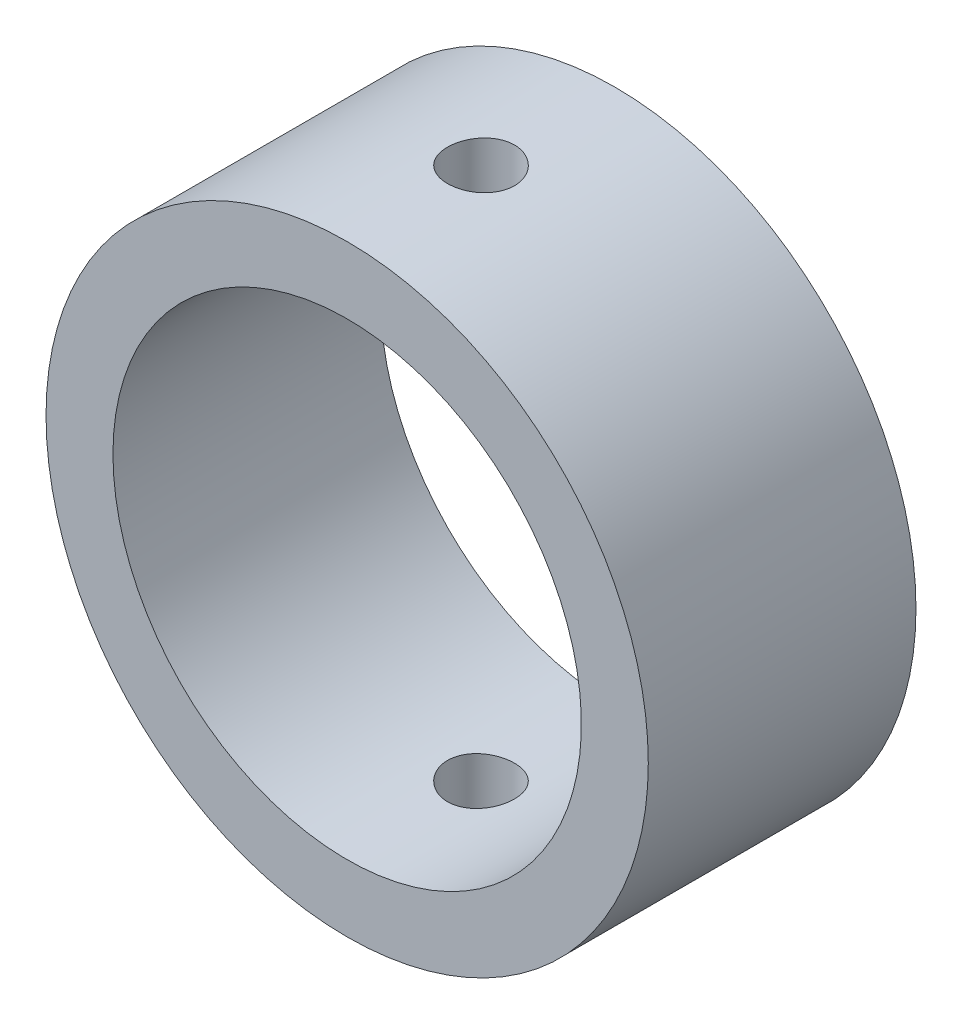
from build123d import *

# Parameters (mm, degrees)
SKETCH1_W   = 571.5
SKETCH1_H   = 508
HOLE1_D     = 889
HOLE2_D     = 127
HOLE2_DEPTH = 131.559094878
HOLE3_D     = 127


with BuildPart() as part:
    # Sketch1 → Revolve1 (revolve)
    with BuildSketch(Plane(origin=(0, 0, 0), x_dir=(1, 0, 0), z_dir=(0, 1, 0))):
        with Locations((285.75, -254)):
            Rectangle(SKETCH1_W, SKETCH1_H)
    revolve(axis=Axis((0, 0, 0), (0, 0, 1)))

    # Hole1 (through all)
    with Locations(Plane(origin=(0, 0, 0), x_dir=(-1, 0, 0), z_dir=(0, 0, -1))):
        with Locations((0, 0)):
            Hole(HOLE1_D / 2)

    # Hole2
    with Locations(Plane(origin=(0, -439.940905122, 0), x_dir=(1, 0, 0), z_dir=(0, 1, 0))):
        with Locations((0, -254)):
            Hole(HOLE2_D / 2, depth=HOLE2_DEPTH)

    # Hole3 (through all)
    with Locations(Plane(origin=(0, 439.940905122, 0), x_dir=(-1, 0, 0), z_dir=(0, -1, 0))):
        with Locations((0, -254)):
            Hole(HOLE3_D / 2)


solid = part.part
